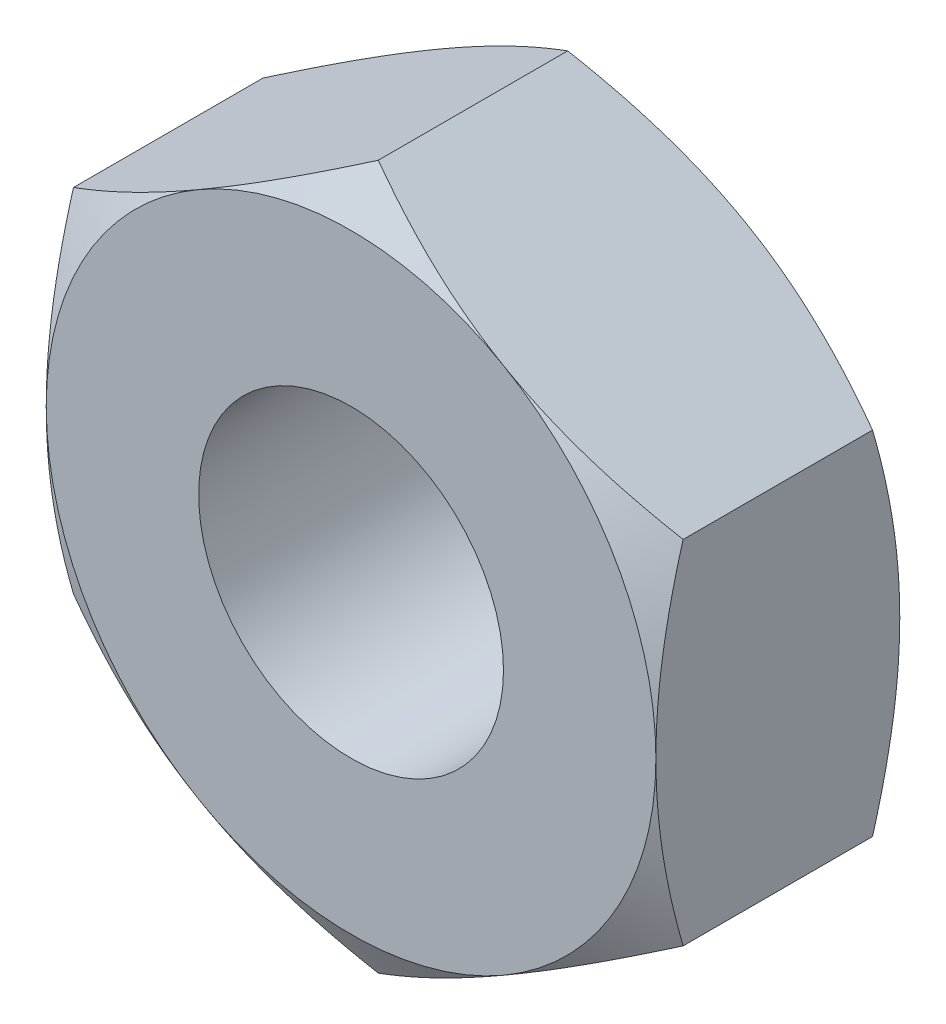
from build123d import *

# Parameters (mm, degrees)
BOSS_EXTRUDE1_DEPTH      = 1
BOSS_EXTRUDE1_DEPTH_BACK = 1
SKETCH2_R                = 1.25
SKETCH3_OUTSIDE_W        = 26.976
SKETCH3_OUTSIDE_H        = 27.75
SKETCH3_OUTSIDE_R        = 2.5
CUT_EXTRUDE1_DEPTH       = 5.310839052
CUT_EXTRUDE1_DRAFT       = -60
MIRROR1_COPY_1_SKETCH_W  = 26.976
MIRROR1_COPY_1_SKETCH_H  = 27.75
MIRROR1_COPY_1_SKETCH_R  = 2.5
MIRROR1_COPY_1_DEPTH     = 5.310839052
MIRROR1_COPY_1_DRAFT     = -60


with BuildPart() as part:
    # Sketch2 → Boss-Extrude1 (new, two sides: drawn at the far end of the back side and taken through both)
    with BuildSketch(Plane.XY.offset(-BOSS_EXTRUDE1_DEPTH_BACK)):
        Polygon((0, 2.886751346), (-2.5, 1.443375673), (-2.5, -1.443375673), (0, -2.886751346), (2.5, -1.443375673), (2.5, 1.443375673), align=None)
        Circle(SKETCH2_R, mode=Mode.SUBTRACT)
    extrude(amount=BOSS_EXTRUDE1_DEPTH + BOSS_EXTRUDE1_DEPTH_BACK)


with BuildPart() as cut_extrude1_tool:
    # Sketch3 outside → Cut-Extrude1 (with draft: the straight prism first)
    with BuildSketch(Plane.XY.offset(1)):
        Rectangle(SKETCH3_OUTSIDE_W, SKETCH3_OUTSIDE_H)
        Circle(SKETCH3_OUTSIDE_R, mode=Mode.SUBTRACT)
    extrude(amount=-CUT_EXTRUDE1_DEPTH)
    # Cut-Extrude1: the draft: its side faces are tilted about the plane it starts from
    cut_extrude1_sides = [cut_extrude1_tool.faces().sort_by_distance(p)[0] for p in [
        (0, -13.875, -1.655419526),
        (13.488, 0, -1.655419526),
        (0, 13.875, -1.655419526),
        (-13.488, 0, -1.655419526),
        (-2.5, 0, -1.655419526),
    ]]
    draft(cut_extrude1_sides, Plane.XY.offset(1), CUT_EXTRUDE1_DRAFT)


with BuildPart() as part_1:
    add(part.part)

    # Cut-Extrude1: cut by cut_extrude1_tool
    add(cut_extrude1_tool.part, mode=Mode.SUBTRACT)


with BuildPart() as mirror1_copy_1_tool:
    # Mirror1 copy 1 sketch → Mirror1 copy 1 (with draft: the straight prism first)
    with BuildSketch(Plane(origin=(0, 0, -1), x_dir=(1, 0, 0), z_dir=(0, 0, -1))):
        Rectangle(MIRROR1_COPY_1_SKETCH_W, MIRROR1_COPY_1_SKETCH_H)
        Circle(MIRROR1_COPY_1_SKETCH_R, mode=Mode.SUBTRACT)
    extrude(amount=-MIRROR1_COPY_1_DEPTH)
    # Mirror1 copy 1: the draft: its side faces are tilted about the plane it starts from
    mirror1_copy_1_sides = [mirror1_copy_1_tool.faces().sort_by_distance(p)[0] for p in [
        (0, -13.875, 1.655419526),
        (13.488, 0, 1.655419526),
        (0, 13.875, 1.655419526),
        (-13.488, 0, 1.655419526),
        (-2.5, 0, 1.655419526),
    ]]
    draft(mirror1_copy_1_sides, Plane(origin=(0, 0, -1), x_dir=(1, 0, 0), z_dir=(0, 0, -1)), MIRROR1_COPY_1_DRAFT)


with BuildPart() as part_2:
    add(part_1.part)

    # Mirror1 copy 1: cut by mirror1_copy_1_tool
    add(mirror1_copy_1_tool.part, mode=Mode.SUBTRACT)


solid = part_2.part
